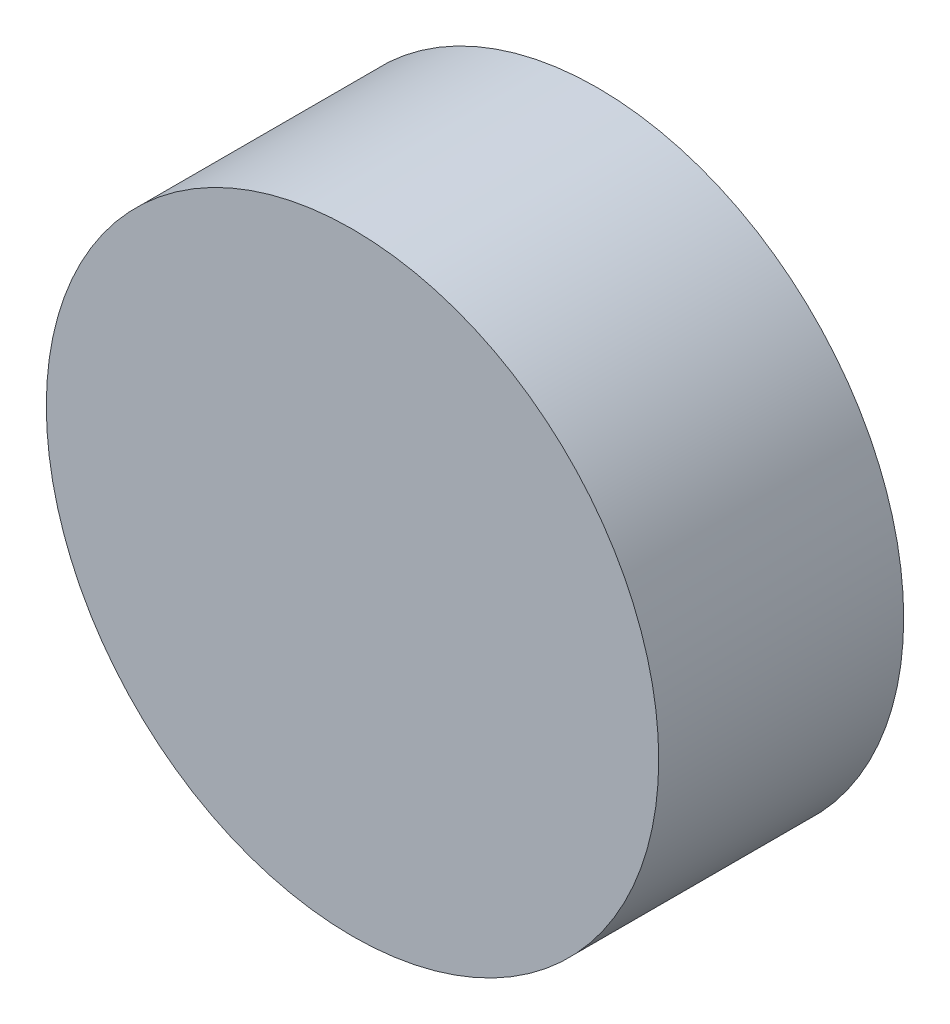
from build123d import *

# Parameters (mm, degrees)
SKETCH_1_R      = 5
EXTRUDE_1_DEPTH = 4


with BuildPart() as part:
    # 草图1 → 凸台-拉伸1 (new body)
    with BuildSketch(Plane.XY):
        Circle(SKETCH_1_R)
    extrude(amount=EXTRUDE_1_DEPTH)


solid = part.part
